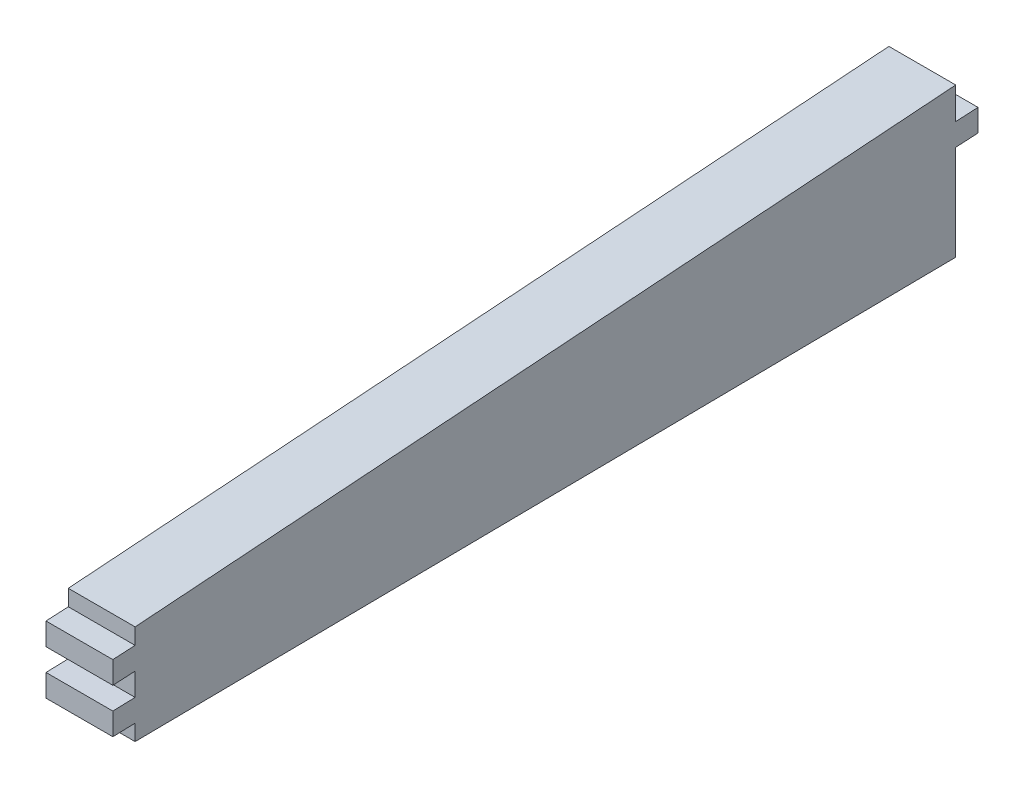
from build123d import *

# Parameters (mm, degrees)
BOSS_EXTRUDE1_DEPTH = 9.525


with BuildPart() as part:
    # Sketch2 → Boss-Extrude1 (new body)
    with BuildSketch(Plane(origin=(243.017706631, 0, 0), x_dir=(0, 0, -1), z_dir=(1, 0, 0))):
        Polygon((-1497.606194078, 359.289887379), (-1500.781194078, 359.19367666), (-1500.781194078, 356.01867666), (-1497.606194078, 356.114887379), (-1497.606194078, 353.831713156), (-1380.66036066, 355.140640763), (-1380.66036066, 368.70917799), (-1377.48536066, 368.876768334), (-1377.48536066, 372.051768334), (-1380.66036066, 371.88417799), (-1380.66036066, 376.40218609), (-1497.606194078, 367.994441226), (-1497.606194078, 365.711267003), (-1500.781194078, 365.54367666), (-1500.781194078, 362.36867666), (-1497.606194078, 362.536267003), align=None)
    extrude(amount=BOSS_EXTRUDE1_DEPTH)


solid = part.part
